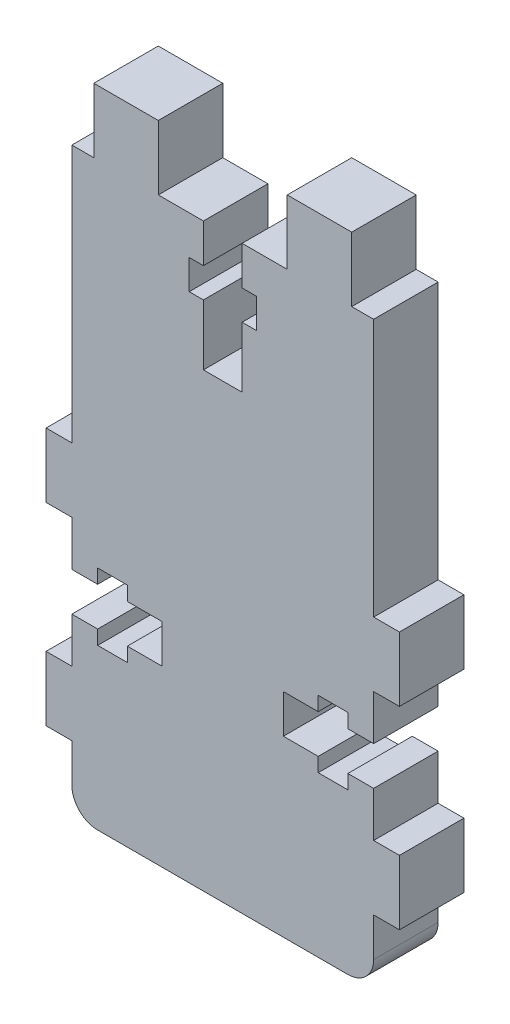
from build123d import *

# Parameters (mm, degrees)
BOSS_EXTRU_1_DEPTH = 5
FILLET1_R          = 2


with BuildPart() as part:
    # Esquisse1 → Boss.-Extru.1 (new body)
    with BuildSketch(Plane.XY):
        Polygon((1.7, 50), (1.7, 45), (0, 45), (0, 25), (-2, 25), (-2, 20), (0, 20), (0, 16.5), (2, 16.5), (2, 17.6), (4.3, 17.6), (4.3, 16.5), (7, 16.5), (7, 13.5), (4.3, 13.5), (4.3, 12.4), (2, 12.4), (2, 13.5), (0, 13.5), (0, 10), (-2, 10), (-2, 5), (0, 5), (0, 0), (23.4, 0), (23.4, 5), (25.4, 5), (25.4, 10), (23.4, 10), (23.4, 13.5), (21.4, 13.5), (21.4, 12.4), (19.1, 12.4), (19.1, 13.5), (16.4, 13.5), (16.4, 16.5), (19.1, 16.5), (19.1, 17.6), (21.4, 17.6), (21.4, 16.5), (23.4, 16.5), (23.4, 20), (25.4, 20), (25.4, 25), (23.4, 25), (23.4, 45), (21.7, 45), (21.7, 50), (16.7, 50), (16.7, 45), (13.2, 45), (13.2, 42), (14.3, 42), (14.3, 39.7), (13.2, 39.7), (13.2, 35), (10.2, 35), (10.2, 39.7), (9.1, 39.7), (9.1, 42), (10.2, 42), (10.2, 45), (6.7, 45), (6.7, 50), align=None)
    extrude(amount=BOSS_EXTRU_1_DEPTH)

    # Fillet1
    fillet1_edges = [part.edges().sort_by_distance(p)[0] for p in [
        (23.4, 0, 2.5),
        (0, 0, 2.5),
    ]]
    fillet(fillet1_edges, radius=FILLET1_R)


solid = part.part
